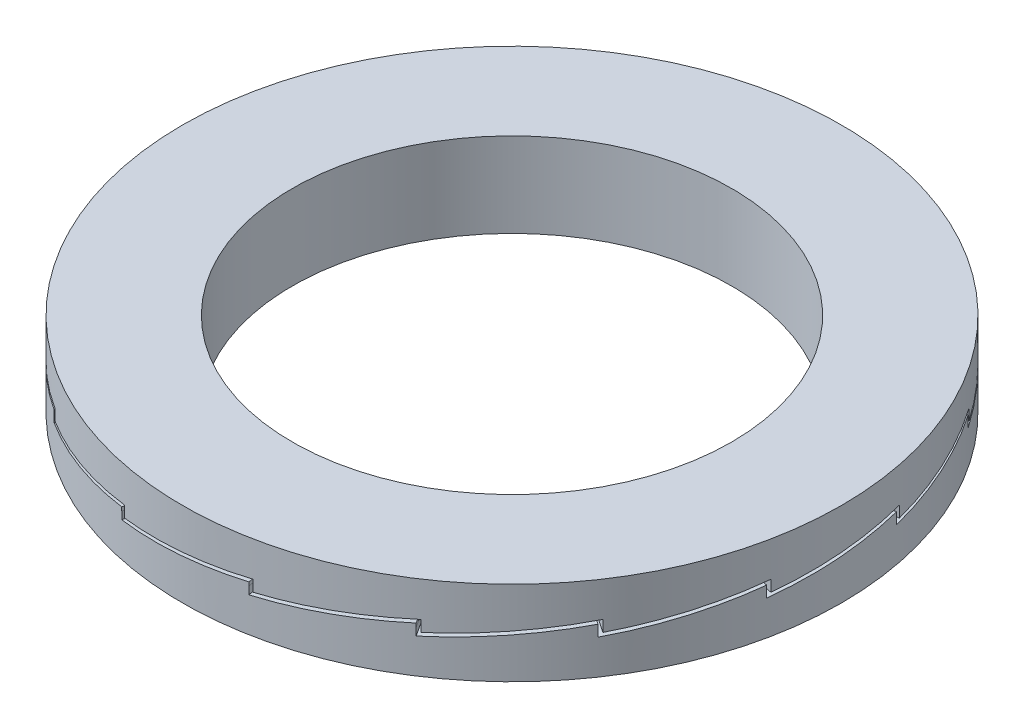
from build123d import *

# Parameters (mm, degrees)
SKETCH3_W                 = 3.25
SKETCH3_H                 = 2.5
PATTERN_CUT_PROFILE_COUNT = 16
PATTERN_CUT_PROFILE_ANGLE = 337.5


with BuildPart() as part:
    # Sketch3 → Base-Revolve (revolve)
    with BuildSketch(Plane.XY):
        with Locations((8.125, 0)):
            Rectangle(SKETCH3_W, SKETCH3_H)
    revolve(axis=Axis((0, -1.25, 0), (0, 1, 0)))

    # Sketch12 → Cut-Profile section 0
    with BuildSketch(Plane(origin=(8.965610702, 0, 0), x_dir=(0, 0, -1), z_dir=(1, 0, 0))):
        with BuildLine():
            Line((-1.881536743, -0.213883571), (1.685204956, 0.098165894))
            Line((1.685204956, 0.098165894), (1.685204956, 0))
            Line((1.685204956, 0), (1.78337085, 0))
            Line((1.78337085, 0), (1.78337085, 0.205295168))
            Line((1.78337085, 0.205295168), (-1.78337085, -0.106754297))
            Line((-1.78337085, -0.106754297), (-1.78337085, 0))
            Line((-1.78337085, 0), (-1.881536743, 0))
            Line((-1.881536743, 0), (-1.881536743, -0.213883571))
        make_face()
    # Sketch15 → Cut-Profile section 1
    with BuildSketch(Plane(origin=(9.75, 0, 0), x_dir=(0, 0, -1), z_dir=(1, 0, 0))):
        with BuildLine():
            Line((-2.050113694, 0), (-1.939395582, 0))
            Line((-1.939395582, 0), (-1.939395582, -0.120404692))
            Line((-1.939395582, -0.120404692), (1.939395582, 0.218945563))
            Line((1.939395582, 0.218945563), (1.939395582, 0))
            Line((1.939395582, 0), (1.82867747, 0))
            Line((1.82867747, 0), (1.82867747, 0.110718112))
            Line((1.82867747, 0.110718112), (-2.050113694, -0.228632143))
            Line((-2.050113694, -0.228632143), (-2.050113694, 0))
        make_face()
    cut_profile = loft(mode=Mode.SUBTRACT)

    # Pattern-Cut-Profile: Cut-Profile ×16 about axis
    pattern_cut_profile_axis = Axis((0, -1.25, 0), (0, 1, 0))
    for i in range(1, PATTERN_CUT_PROFILE_COUNT):
        add(cut_profile.rotate(pattern_cut_profile_axis, i * PATTERN_CUT_PROFILE_ANGLE / (PATTERN_CUT_PROFILE_COUNT - 1)), mode=Mode.SUBTRACT)


solid = part.part
